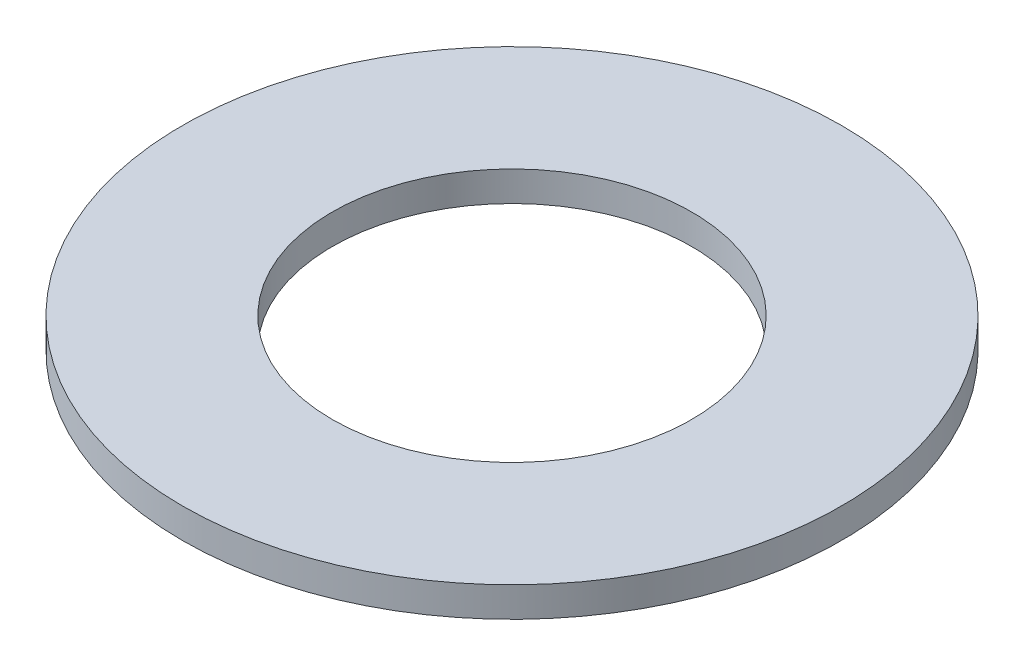
from build123d import *

# Parameters (mm, degrees)
ESQUISSE1_R        = 5.5
ESQUISSE1_R_2      = 3
BOSS_EXTRU_1_DEPTH = 0.5


with BuildPart() as part:
    # Esquisse1 → Boss.-Extru.1 (new body)
    with BuildSketch(Plane(origin=(0, 0, 0), x_dir=(1, 0, 0), z_dir=(0, 1, 0))):
        with Locations(Location((0, 0, 0), (0, 0, 270))):
            Circle(ESQUISSE1_R)
        with Locations(Location((0, 0, 0), (0, 0, 270))):
            Circle(ESQUISSE1_R_2, mode=Mode.SUBTRACT)
    extrude(amount=BOSS_EXTRU_1_DEPTH)


solid = part.part
